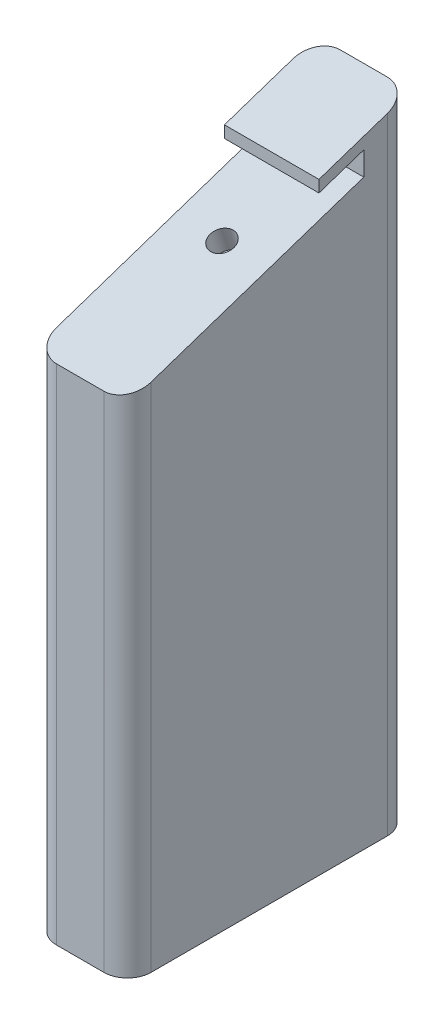
from build123d import *

# Parameters (mm, degrees)
SKETCH1_W               = 25.4
SKETCH1_H               = 76.2
BOSS_EXTRUDE1_DEPTH     = 160.782
CUT_EXTRUDE2_DEPTH      = 168.175421411
CUT_EXTRUDE2_DEPTH_BACK = 168.175421411
SKETCH5_R               = 3.175
CUT_EXTRUDE3_DEPTH      = 6.35
BOSS_EXTRUDE2_REACH     = 177.247
SKETCH1_5_W             = 25.4
SKETCH1_5_H             = 12.7
SKETCH8_W               = 25.4
SKETCH8_H               = 3.175
BOSS_EXTRUDE3_DEPTH     = 12.7
FILLET1_R               = 6.35


with BuildPart() as part:
    # Sketch1 → Boss-Extrude1 (new body)
    with BuildSketch(Plane(origin=(0, 0, 0), x_dir=(1, 0, 0), z_dir=(0, 1, 0))):
        Rectangle(SKETCH1_W, SKETCH1_H)
    extrude(amount=BOSS_EXTRUDE1_DEPTH)

    # Sketch4 → Cut-Extrude2 (cut, two sides: drawn at the far end of the back side and taken through both)
    with BuildSketch(Plane(origin=(12.7, 0, 0), x_dir=(0, 0, -1), z_dir=(1, 0, 0)).offset(-CUT_EXTRUDE2_DEPTH_BACK)):
        Polygon((38.1, 160.782), (-38.1, 160.782), (-38.1, 135.285836654), align=None)
    extrude(amount=CUT_EXTRUDE2_DEPTH + CUT_EXTRUDE2_DEPTH_BACK, mode=Mode.SUBTRACT)

    # Sketch5 → Cut-Extrude3 (cut)
    with BuildSketch(Plane(origin=(0, 133.129531097, 44.544517993), x_dir=(1, 0, 0), z_dir=(0, 0.9483236552061992, 0.3173046564050927))):
        with Locations((0, 46.971851591)):
            Circle(SKETCH5_R)
    extrude(amount=-CUT_EXTRUDE3_DEPTH, mode=Mode.SUBTRACT)

    # Boss-Extrude2: from a plane face, 177.247 long prism both ways, kept between that surface and its translate by the depth
    boss_extrude2_start = Plane(origin=(-12.7, 135.285836654, 38.1), z_dir=(0, -0.9483236552061991, -0.31730465640509276)) * Box(710.988, 710.988, 355.494, align=(Align.CENTER, Align.CENTER, Align.MIN), mode=Mode.PRIVATE)
    boss_extrude2_end = Plane(origin=(-12.7, 144.810836654, 38.1), z_dir=(0, -0.9483236552061991, -0.31730465640509276)) * Box(710.988, 710.988, 355.494, align=(Align.CENTER, Align.CENTER, Align.MIN), mode=Mode.PRIVATE)
    # Sketch1<5> → Boss-Extrude2 (add, from a surface)
    with BuildSketch(Plane(origin=(0, 0, 0), x_dir=(1, 0, 0), z_dir=(0, 1, 0)), mode=Mode.PRIVATE) as boss_extrude2_sk1:
        with Locations((0, 31.75)):
            Rectangle(SKETCH1_5_W, SKETCH1_5_H)
    boss_extrude2_tool1 = extrude(boss_extrude2_sk1.sketch, amount=BOSS_EXTRUDE2_REACH, both=True, mode=Mode.PRIVATE)
    add(((boss_extrude2_tool1 - boss_extrude2_start) & boss_extrude2_end).solids().sort_by_distance((0, 147.026476, 3.010928))[0])

    # Sketch8 → Boss-Extrude3 (add, along a direction that is not the sketch's normal)
    with BuildSketch(Plane.XY.offset(-25.4)):
        with Locations((0, 164.470139442)):
            Rectangle(SKETCH8_W, SKETCH8_H)
    extrude(amount=BOSS_EXTRUDE3_DEPTH, dir=(0, -0.31730465640509276, 0.9483236552061991))

    # Fillet1
    fillet1_edges = [part.edges().sort_by_distance(p)[0] for p in [
        (-12.7, 85.1535, -38.1),
        (12.7, 85.1535, -38.1),
        (-12.7, 67.642918327, 38.1),
        (12.7, 67.642918327, 38.1),
    ]]
    fillet(fillet1_edges, radius=FILLET1_R)


solid = part.part
